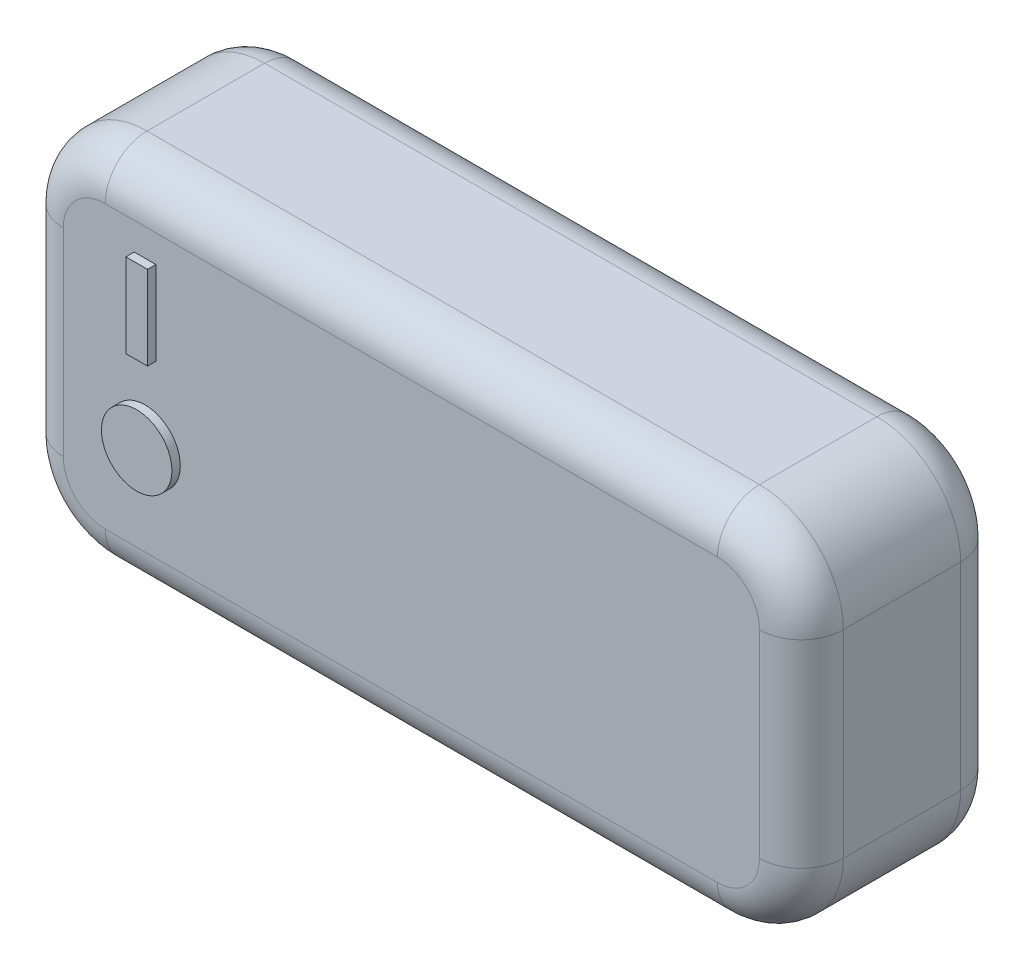
from build123d import *

# Parameters (mm, degrees)
CROQUIS1_W              = 93
CROQUIS1_H              = 43.6
SALIENTE_EXTRUIR1_DEPTH = 24
REDONDEO1_R             = 10
REDONDEO2_R             = 5
CROQUIS2_R              = 1.795301333
CROQUIS2_W              = 5.26615661
CROQUIS2_H              = 9.314898328
CROQUIS2_W_2            = 1.780690374
CROQUIS2_H_2            = 3.893669573
CORTAR_EXTRUIR1_DEPTH   = 10
CROQUIS4_R              = 4.202442578
CROQUIS4_W              = 2.57850106
CROQUIS4_H              = 9.991691608
SALIENTE_EXTRUIR2_DEPTH = 1


with BuildPart() as part:
    # Croquis1 → Saliente-Extruir1 (new body)
    with BuildSketch(Plane.XY):
        Rectangle(CROQUIS1_W, CROQUIS1_H)
    extrude(amount=SALIENTE_EXTRUIR1_DEPTH)

    # Redondeo1
    redondeo1_edges = [part.edges().sort_by_distance(p)[0] for p in [
        (46.5, -21.8, 12),
        (-46.5, -21.8, 12),
        (-46.5, 21.8, 12),
        (46.5, 21.8, 12),
    ]]
    fillet(redondeo1_edges, radius=REDONDEO1_R)

    # Redondeo2
    redondeo2_edges = [part.edges().sort_by_distance(p)[0] for p in [
        (46.5, 0, 0),
        (46.5, 0, 24),
        (0, -21.8, 0),
        (-46.5, 0, 0),
        (0, 21.8, 0),
        (-43.571067812, 18.871067812, 0),
        (-43.571067812, -18.871067812, 0),
        (43.571067812, 18.871067812, 0),
        (43.571067812, -18.871067812, 0),
        (0, -21.8, 24),
        (0, 21.8, 24),
        (-46.5, 0, 24),
        (-43.571067812, 18.871067812, 24),
        (-43.571067812, -18.871067812, 24),
        (43.571067812, 18.871067812, 24),
        (43.571067812, -18.871067812, 24),
    ]]
    fillet(redondeo2_edges, radius=REDONDEO2_R)

    # Croquis2 → Cortar-Extruir1 (cut)
    with BuildSketch(Plane.ZY.offset(46.5)):
        with Locations((12, 7.984643734)):
            Circle(CROQUIS2_R)
        with Locations((12, -7.142550836)):
            Rectangle(CROQUIS2_W, CROQUIS2_H)
        with Locations((12, 2.792227185)):
            Rectangle(CROQUIS2_W_2, CROQUIS2_H_2)
    extrude(amount=-CORTAR_EXTRUIR1_DEPTH, mode=Mode.SUBTRACT)

    # Croquis4 → Saliente-Extruir2 (add)
    with BuildSketch(Plane.XY.offset(24)):
        with Locations((-31.747794301, -5.801627385)):
            Circle(CROQUIS4_R)
        with Locations((-31.747794301, 8.541284761)):
            Rectangle(CROQUIS4_W, CROQUIS4_H)
    extrude(amount=SALIENTE_EXTRUIR2_DEPTH)


solid = part.part
